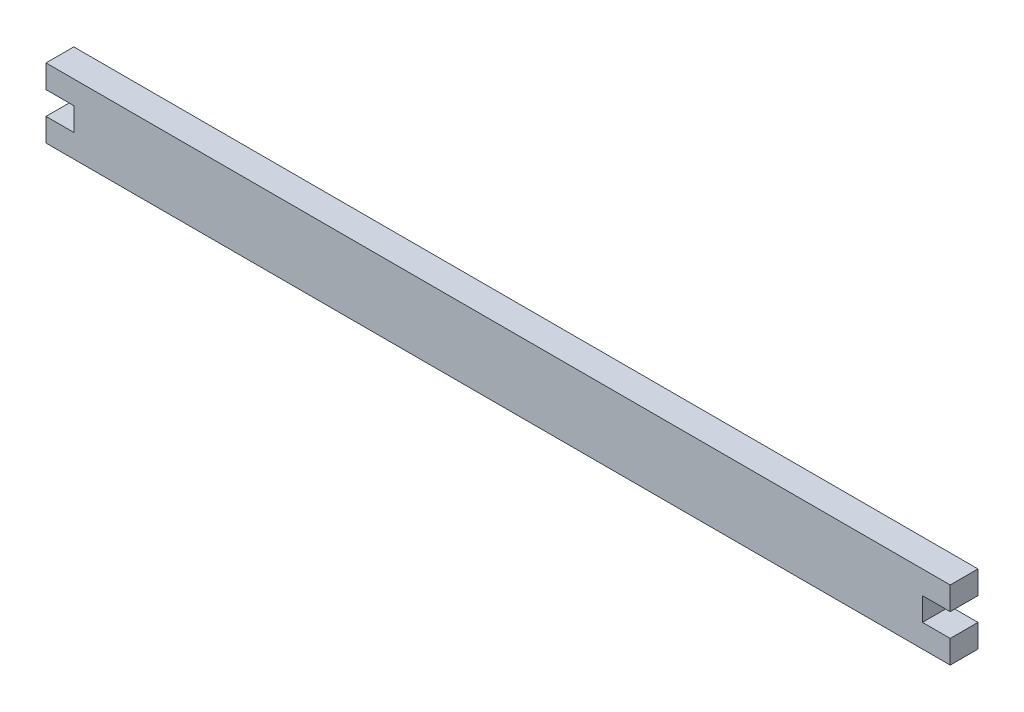
from build123d import *

# Parameters (mm, degrees)
SKETCH1_W             = 586
SKETCH1_H             = 45
EXTRUDE_357_DEPTH     = 18
CUT_EXTRUDE_572_REACH = 296.413
SKETCH2_W             = 18
SKETCH2_H             = 15


with BuildPart() as part:
    # Sketch1 → Extrude 357 (new body)
    with BuildSketch(Plane.XY):
        Rectangle(SKETCH1_W, SKETCH1_H)
    extrude(amount=EXTRUDE_357_DEPTH)

    # Sketch2 → Cut-Extrude 572 (cut, up to next)
    with BuildSketch(Plane.XY.offset(18), mode=Mode.PRIVATE) as cut_extrude_572_sk1:
        with Locations((-284, 0)):
            Rectangle(SKETCH2_W, SKETCH2_H)
    cut_extrude_572_tool1 = extrude(cut_extrude_572_sk1.sketch, amount=-CUT_EXTRUDE_572_REACH, mode=Mode.PRIVATE) & part.part
    cut_extrude_572 = cut_extrude_572_tool1.solids().sort_by_distance((-284, 0, 18))[0]
    add(cut_extrude_572, mode=Mode.SUBTRACT)

    # Mirror1: Cut-Extrude 572 across plane
    add(cut_extrude_572.mirror(Plane(origin=(0, 0, 0), x_dir=(0, 0, 1), z_dir=(1, 0, 0))), mode=Mode.SUBTRACT)


solid = part.part
